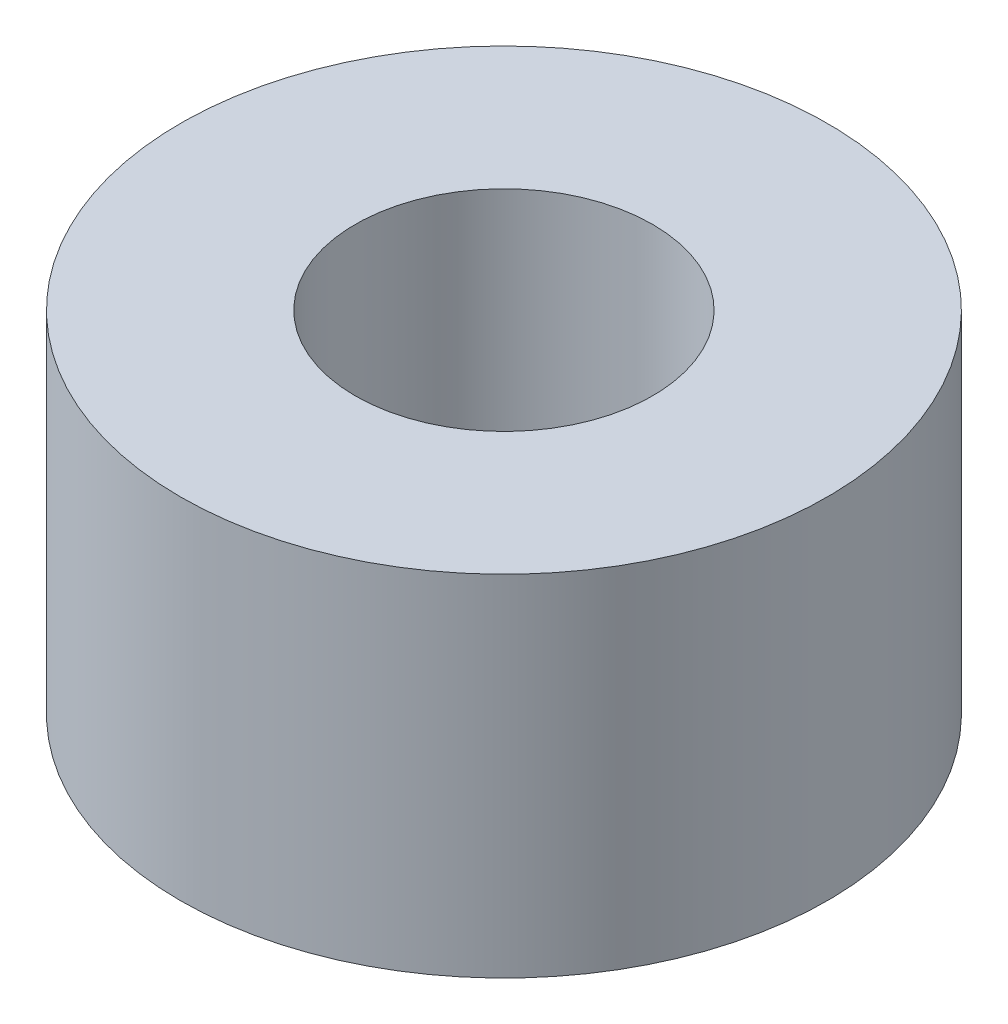
from build123d import *

# Parameters (mm, degrees)
SKETCH2_R           = 4.699
SKETCH2_R_2         = 2.159
BOSS_EXTRUDE1_DEPTH = 5.08


with BuildPart() as part:
    # Sketch2 → Boss-Extrude1 (new body)
    with BuildSketch(Plane(origin=(0, 0, 0), x_dir=(1, 0, 0), z_dir=(0, 1, 0))):
        with Locations(Location((0, 0, 0), (0, 0, 270))):
            Circle(SKETCH2_R)
        with Locations(Location((0, 0, 0), (0, 0, 270))):
            Circle(SKETCH2_R_2, mode=Mode.SUBTRACT)
    extrude(amount=BOSS_EXTRUDE1_DEPTH)


solid = part.part
